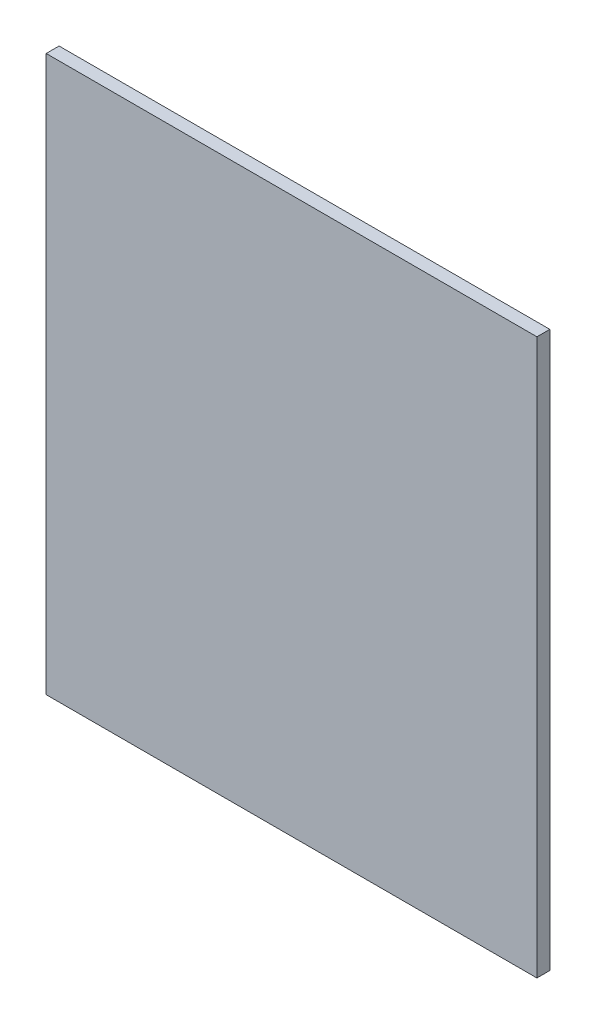
from build123d import *

# Parameters (mm, degrees)
SKETCH1_W           = 482.6
SKETCH1_H           = 546.1
BOSS_EXTRUDE1_DEPTH = 12.7


with BuildPart() as part:
    # Sketch1 → Boss-Extrude1 (new body)
    with BuildSketch(Plane.XY):
        Rectangle(SKETCH1_W, SKETCH1_H)
    extrude(amount=BOSS_EXTRUDE1_DEPTH)


solid = part.part
